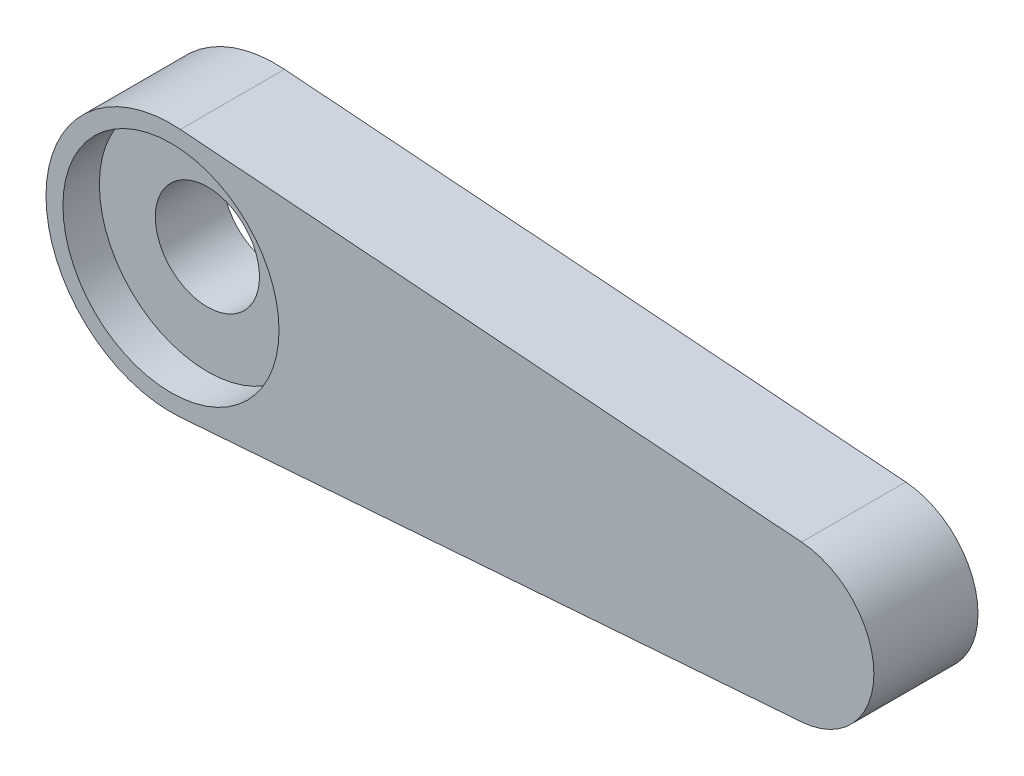
from build123d import *

# Parameters (mm, degrees)
EXTRUDE_1_DEPTH     = 10
SKETCH_2_R          = 10.375
CUT_EXTRUDE_1_DEPTH = 3.5
SKETCH_3_R          = 5
CUT_EXTRUDE_2_DEPTH = 70.283836499


with BuildPart() as part:
    # 草图1 → 凸台-拉伸1 (new body)
    with BuildSketch(Plane.XY):
        with BuildLine():
            Line((0.9, -11.966202405), (60.5625, -7.478876503))
            ThreePointArc((60.5625, -7.478876503), (67.5, 0), (60.5625, 7.478876503))
            Line((60.5625, 7.478876503), (0.9, 11.966202405))
            ThreePointArc((0.9, 11.966202405), (-12, 0), (0.9, -11.966202405))
        make_face()
    extrude(amount=EXTRUDE_1_DEPTH)

    # 草图2 → 切除-拉伸1 (cut)
    with BuildSketch(Plane.XY.offset(10)):
        Circle(SKETCH_2_R)
    extrude(amount=-CUT_EXTRUDE_1_DEPTH, mode=Mode.SUBTRACT)

    # 草图3 → 切除-拉伸2 (cut, through all)
    with BuildSketch(Plane(origin=(0, 0, 0), x_dir=(-1, 0, 0), z_dir=(0, 0, -1))):
        Circle(SKETCH_3_R)
    extrude(amount=-CUT_EXTRUDE_2_DEPTH, mode=Mode.SUBTRACT)


solid = part.part
